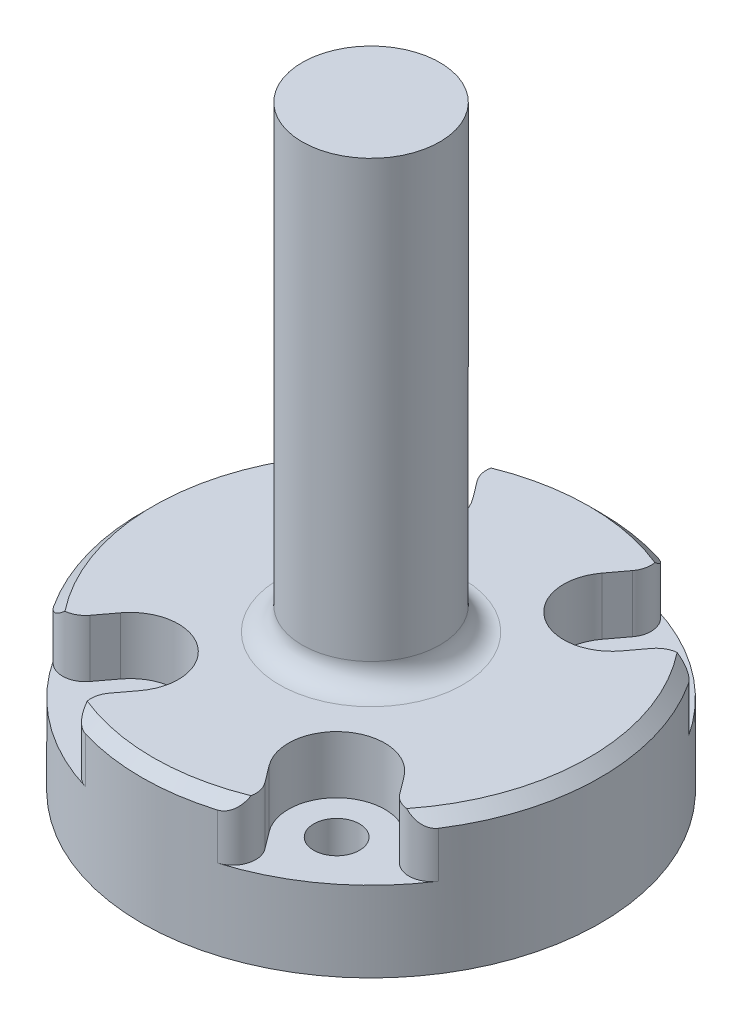
from build123d import *

# Parameters (mm, degrees)
SKETCH_2_R          = 1.0000000000000002
SKETCH_2_R_2        = 0.9999999999999998
CUT_EXTRUDE_1_DEPTH = 10
SKETCH_3_R          = 1.0000000000000002
SKETCH_3_R_2        = 0.9999999999999998
CUT_EXTRUDE_2_DEPTH = 2.5
FILLET_1_R          = 1
FILLET_2_R          = 1


with BuildPart() as part:
    # 草图1 → 旋转1 (revolve)
    with BuildSketch(Plane.XY, mode=Mode.PRIVATE) as revolve_1_sk:
        Polygon((-1.97e-15, 26), (2.999999999999997, 26), (3, 6), (9.5, 5.999999999999999), (10.000000000000002, 5.5), (10, -1.2e-16), (5.000000000000001, -6.1e-16), (5.000000000000002, 2.9999999999999996), (8.7e-16, 2.999999999999999), align=None)
    revolve(revolve_1_sk.sketch.rotate(Axis((0, 9.947317903416637, 0), (0, -1, 0)), 90), axis=Axis((0, 9.947317903416637, 0), (0, -1, 0)))

    # 草图2 → 切除-拉伸1 (cut)
    with BuildSketch(Plane(origin=(0, 6, 0), x_dir=(1, 0, 0), z_dir=(0, 1, 0))):
        with Locations(Location((-4.5, 6.000000000000001, 0), (0, 0, 270))):
            Circle(SKETCH_2_R)
        with Locations(Location((4.5, 6.000000000000003, 0), (0, 0, 270))):
            Circle(SKETCH_2_R_2)
        with Locations(Location((4.5, -5.999999999999997, 0), (0, 0, 270))):
            Circle(SKETCH_2_R_2)
        with Locations(Location((-4.5, -5.999999999999999, 0), (0, 0, 270))):
            Circle(SKETCH_2_R)
    extrude(amount=-CUT_EXTRUDE_1_DEPTH, mode=Mode.SUBTRACT)

    # 草图3 → 切除-拉伸2 (cut)
    # profile 1 of 8: a face of its own
    with BuildSketch(Plane(origin=(0, 6, 0), x_dir=(1, 0, 0), z_dir=(0, 1, 0))):
        with BuildLine():
            Line((-9.157565431651806, 8.710087242202405), (-7.2389927145122455, 6.151990286016327))
            ThreePointArc((-7.2389927145121735, 6.151990286016362), (-5.700000000000015, 7.599999999999989), (-3.8789927145123357, 8.67199028601625))
            Line((-3.8789927145122554, 8.67199028601634), (-5.797565431651803, 11.230087242202407))
            Line((-5.797565431651803, 11.230087242202407), (-9.157565431651806, 8.710087242202405))
        make_face()
    # profile 2 of 8: a face of its own
    with BuildSketch(Plane(origin=(0, 6, 0), x_dir=(1, 0, 0), z_dir=(0, 1, 0))):
        with BuildLine():
            ThreePointArc((-3.8789927145123357, 8.67199028601625), (-5.700000000000015, 7.599999999999989), (-7.2389927145121735, 6.151990286016362))
            Line((-7.2389927145122455, 6.151990286016327), (-6.18, 4.739999999999999))
            ThreePointArc((-6.18, 4.739999999999998), (-3.24, 4.3199999999999985), (-2.819999999999999, 7.259999999999998))
            Line((-2.819999999999999, 7.259999999999998), (-3.8789927145122554, 8.67199028601634))
        make_face()
        with Locations(Location((-4.5, 6.000000000000001, 0), (0, 0, 270))):
            Circle(SKETCH_3_R, mode=Mode.SUBTRACT)
    # profile 3 of 8: a face of its own
    with BuildSketch(Plane(origin=(0, 6, 0), x_dir=(1, 0, 0), z_dir=(0, 1, 0))):
        with BuildLine():
            ThreePointArc((7.2389927145121815, 6.1519902860163524), (5.700000000000022, 7.599999999999984), (3.878992714512337, 8.67199028601625))
            Line((3.8789927145122567, 8.671990286016342), (2.819999999999999, 7.259999999999998))
            ThreePointArc((2.8199999999999985, 7.259999999999998), (3.24, 4.319999999999999), (6.18, 4.739999999999999))
            Line((6.18, 4.739999999999999), (7.238992714512243, 6.151990286016323))
        make_face()
        with Locations(Location((4.5, 6.000000000000003, 0), (0, 0, 270))):
            Circle(SKETCH_3_R_2, mode=Mode.SUBTRACT)
    # profile 4 of 8: a face of its own
    with BuildSketch(Plane(origin=(0, 6, 0), x_dir=(1, 0, 0), z_dir=(0, 1, 0))):
        with BuildLine():
            Line((5.797565431651803, 11.230087242202407), (3.8789927145122567, 8.671990286016342))
            ThreePointArc((3.878992714512337, 8.67199028601625), (5.700000000000022, 7.599999999999984), (7.2389927145121815, 6.1519902860163524))
            Line((7.238992714512243, 6.151990286016323), (9.157565431651806, 8.710087242202405))
            Line((9.157565431651806, 8.710087242202405), (5.797565431651803, 11.230087242202407))
        make_face()
    # profile 5 of 8: a face of its own
    with BuildSketch(Plane(origin=(0, 6, 0), x_dir=(1, 0, 0), z_dir=(0, 1, 0))):
        with BuildLine():
            Line((2.819999999999999, -7.259999999999998), (3.8789927145122527, -8.671990286016337))
            ThreePointArc((3.8789927145123175, -8.671990286016259), (5.700000000000012, -7.599999999999992), (7.238992714512178, -6.151990286016356))
            Line((7.238992714512243, -6.151990286016323), (6.18, -4.739999999999999))
            ThreePointArc((6.18, -4.739999999999999), (3.24, -4.319999999999999), (2.8199999999999985, -7.259999999999998))
        make_face()
        with Locations(Location((4.5, -5.999999999999997, 0), (0, 0, 270))):
            Circle(SKETCH_3_R_2, mode=Mode.SUBTRACT)
    # profile 6 of 8: a face of its own
    with BuildSketch(Plane(origin=(0, 6, 0), x_dir=(1, 0, 0), z_dir=(0, 1, 0))):
        with BuildLine():
            ThreePointArc((7.238992714512178, -6.151990286016356), (5.700000000000012, -7.599999999999992), (3.8789927145123175, -8.671990286016259))
            Line((3.8789927145122527, -8.671990286016337), (5.797565431651803, -11.230087242202407))
            Line((5.797565431651803, -11.230087242202407), (9.157565431651806, -8.710087242202405))
            Line((9.157565431651806, -8.710087242202405), (7.238992714512243, -6.151990286016323))
        make_face()
    # profile 7 of 8: a face of its own
    with BuildSketch(Plane(origin=(0, 6, 0), x_dir=(1, 0, 0), z_dir=(0, 1, 0))):
        with BuildLine():
            ThreePointArc((-2.819999999999999, -7.259999999999998), (-2.4211060633115498, -5.703015151901651), (-3.239999999999995, -4.320000000000003))
            ThreePointArc((-3.239999999999995, -4.320000000000003), (-4.796984848098346, -3.921106063311549), (-6.18, -4.739999999999998))
            Line((-6.18, -4.739999999999999), (-7.238992714512246, -6.151990286016328))
            ThreePointArc((-7.238992714512174, -6.15199028601636), (-5.7000000000000135, -7.59999999999999), (-3.8789927145123286, -8.671990286016255))
            Line((-3.8789927145122527, -8.671990286016337), (-2.819999999999999, -7.259999999999998))
        make_face()
        with BuildLine():
            ThreePointArc((-3.5, -5.999999999999999), (-5.3944271909999175, -6.447213595499955), (-3.899999999999996, -5.200000000000002))
            ThreePointArc((-3.899999999999996, -5.200000000000002), (-3.605572809000083, -5.5527864045000435), (-3.5, -5.999999999999999))
        make_face(mode=Mode.SUBTRACT)
    # profile 8 of 8: a face of its own
    with BuildSketch(Plane(origin=(0, 6, 0), x_dir=(1, 0, 0), z_dir=(0, 1, 0))):
        with BuildLine():
            ThreePointArc((-3.8789927145123286, -8.671990286016255), (-5.7000000000000135, -7.59999999999999), (-7.238992714512174, -6.15199028601636))
            Line((-7.238992714512246, -6.151990286016328), (-9.157565431651806, -8.710087242202405))
            Line((-9.157565431651806, -8.710087242202405), (-5.797565431651803, -11.230087242202407))
            Line((-5.797565431651803, -11.230087242202407), (-3.8789927145122527, -8.671990286016337))
        make_face()
    extrude(amount=-CUT_EXTRUDE_2_DEPTH, mode=Mode.SUBTRACT)

    # 圆角1
    fillet_1_edges = [part.edges().sort_by_distance(p)[0] for p in [
        (7.5462083154282915, 4.5, -6.56161108723772),
        (4.18620831542829, 4.5, -9.08161108723772),
        (4.18620831542829, 4.5, 9.08161108723772),
        (7.5462083154282915, 4.5, 6.561611087237719),
        (-4.18620831542829, 4.5, 9.08161108723772),
        (-7.546208315428291, 4.5, 6.56161108723772),
        (-7.54620831542829, 4.5, -6.561611087237719),
        (-4.186208315428289, 4.5, -9.08161108723772),
    ]]
    fillet(fillet_1_edges, radius=FILLET_1_R)

    # 圆角2
    fillet_2_edges = [part.edges().sort_by_distance(p)[0] for p in [
        (-7e-16, 6, -3),
    ]]
    fillet(fillet_2_edges, radius=FILLET_2_R)


solid = part.part
